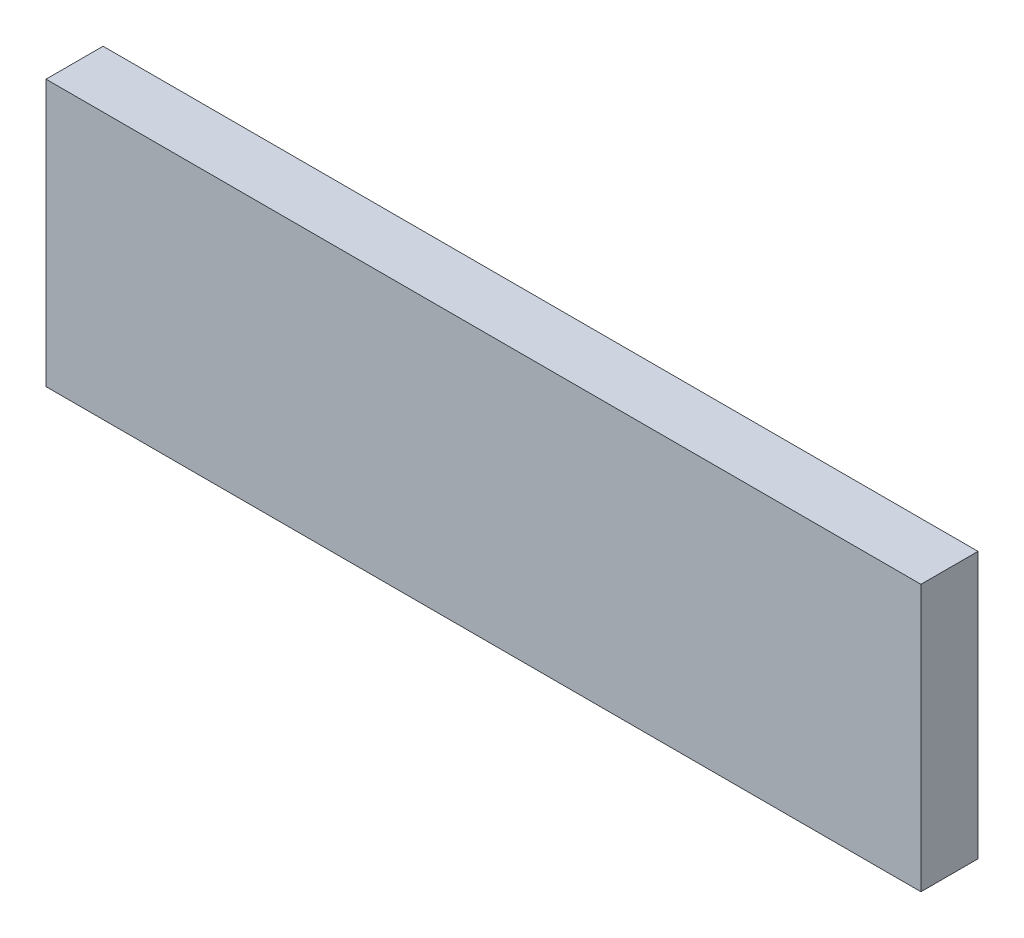
from build123d import *

# Parameters (mm, degrees)
SKETCH1_W           = 46
SKETCH1_H           = 14
BOSS_EXTRUDE1_DEPTH = 3


with BuildPart() as part:
    # Sketch1 → Boss-Extrude1 (new body)
    with BuildSketch(Plane.XY):
        with Locations((23, 7)):
            Rectangle(SKETCH1_W, SKETCH1_H)
    extrude(amount=BOSS_EXTRUDE1_DEPTH)


solid = part.part
